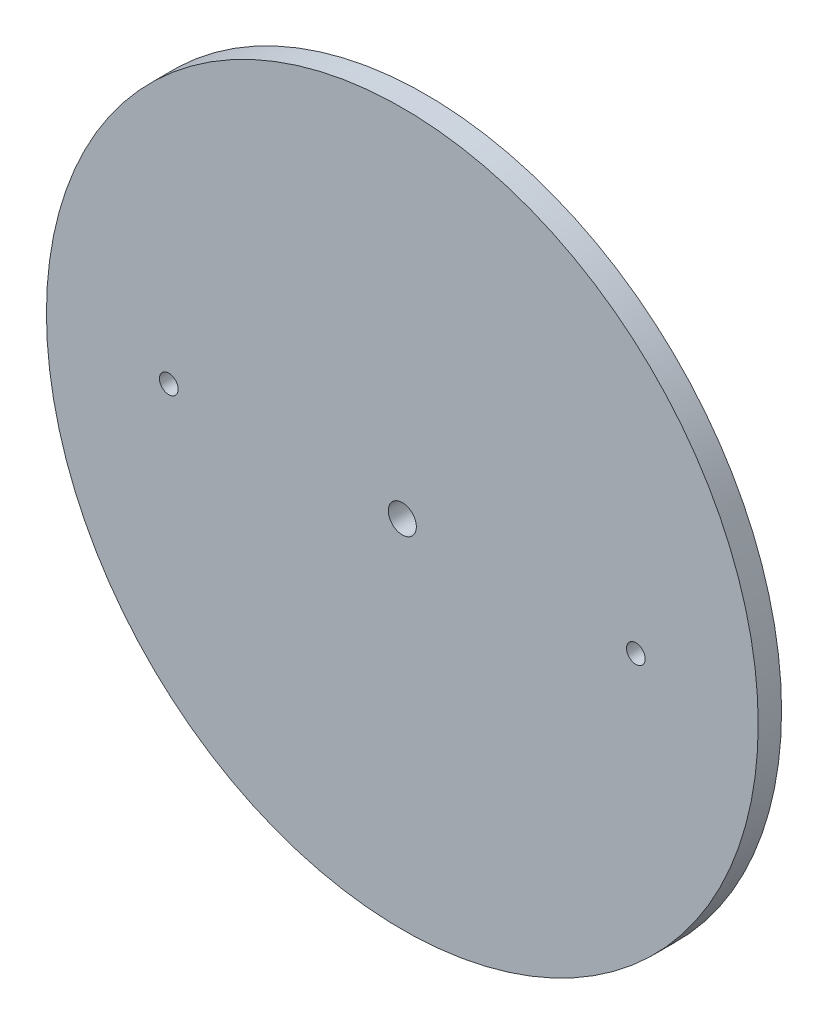
from build123d import *

# Parameters (mm, degrees)
SKETCH1_R           = 76.2
SKETCH1_R_2         = 2
SKETCH1_R_3         = 3
BOSS_EXTRUDE1_DEPTH = 5


with BuildPart() as part:
    # Sketch1 → Boss-Extrude1 (new body)
    with BuildSketch(Plane(origin=(0, 0, -5), x_dir=(-1, 0, 0), z_dir=(0, 0, -1))):
        with Locations(Location((0, 0, 0), (0, 0, 180))):
            Circle(SKETCH1_R)
        with Locations(Location((50, 0, 0), (0, 0, 180))):
            Circle(SKETCH1_R_2, mode=Mode.SUBTRACT)
        with Locations(Location((-50, 0, 0), (0, 0, 180))):
            Circle(SKETCH1_R_2, mode=Mode.SUBTRACT)
        with Locations(Location((0, 0, 0), (0, 0, 180))):
            Circle(SKETCH1_R_3, mode=Mode.SUBTRACT)
    extrude(amount=-BOSS_EXTRUDE1_DEPTH)


solid = part.part
